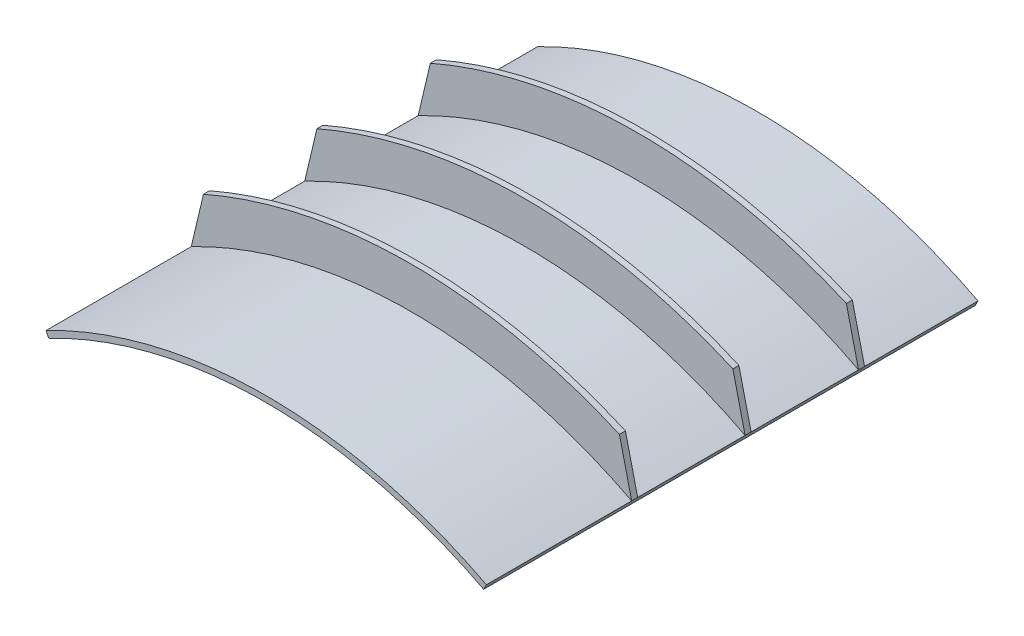
from build123d import *

# Parameters (mm, degrees)
BOSS_EXTRUDE1_DEPTH = 260
BOSS_EXTRUDE2_START = 60
BOSS_EXTRUDE2_DEPTH = 3.175
LPATTERN1_COUNT     = 3
LPATTERN1_PITCH     = 60


with BuildPart() as part:
    # Sketch1 → Boss-Extrude1 (new body)
    with BuildSketch(Plane.XY):
        with BuildLine():
            Line((-116.4605, 224.79887136), (-115, 221.979728804))
            ThreePointArc((-115, 221.979728804), (0, 250), (115, 221.979728804))
            Line((115, 221.979728804), (116.4605, 224.79887136))
            ThreePointArc((116.4605, 224.79887136), (0, 253.175), (-116.4605, 224.79887136))
        make_face()
    extrude(amount=BOSS_EXTRUDE1_DEPTH)

    # Sketch2 → Boss-Extrude2 (add)
    with BuildSketch(Plane.XY.offset(BOSS_EXTRUDE2_START)):
        with BuildLine():
            Line((-110, 252.041663223), (-116.4605, 224.79887136))
            ThreePointArc((-116.4605, 224.79887136), (0, 253.175), (116.4605, 224.79887136))
            Line((116.4605, 224.79887136), (110, 252.041663223))
            ThreePointArc((110, 252.041663223), (0, 275), (-110, 252.041663223))
        make_face()
    boss_extrude2 = extrude(amount=BOSS_EXTRUDE2_DEPTH)

    # LPattern1: Boss-Extrude2 ×3
    with Locations(*[(0, 0, i * LPATTERN1_PITCH) for i in range(1, LPATTERN1_COUNT)]):
        add(boss_extrude2)


solid = part.part
